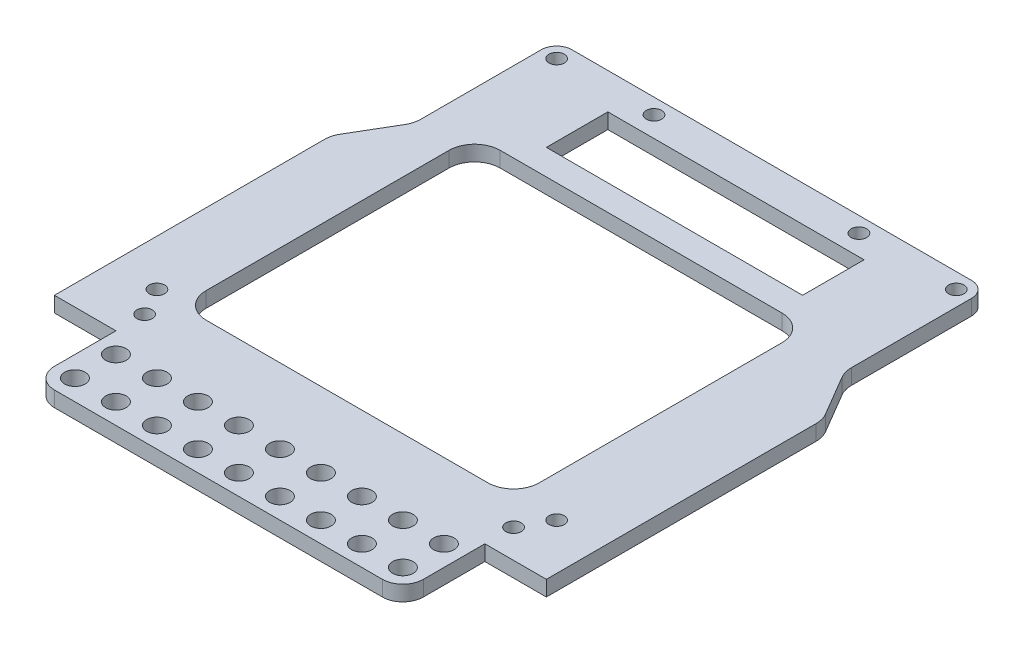
from build123d import *

# Parameters (mm, degrees)
SKETCH1_R            = 1.5
SKETCH1_R_2          = 1.65
SKETCH1_W            = 6
SKETCH1_H            = 28
BOSS_EXTRUDE1_DEPTH  = 3
CUT_EXTRUDE2_REACH   = 109.373
SKETCH3_R            = 1.5
CUT_EXTRUDE3_REACH   = 109.373
SKETCH4_W            = 22.395
SKETCH4_H            = 68
SKETCH6_W            = 51.21
SKETCH6_H            = 5
BOSS_EXTRUDE2_DEPTH  = 3
CUT_EXTRUDE4_REACH   = 109.373
SKETCH7_R            = 1.5
CUT_EXTRUDE5_REACH   = 109.373
SKETCH9_R            = 1.5
CUT_EXTRUDE6_REACH   = 109.373
SKETCH11_R           = 1.5
SKETCH11_R_2         = 2.5
BOSS_EXTRUDE3_DEPTH  = 3
CUT_EXTRUDE7_REACH   = 109.373
CUT_EXTRUDE8_START   = -3
SKETCH13_W           = 4.95
SKETCH13_H           = 15
SKETCH13_W_2         = 6.078763038
SKETCH13_H_2         = 4.767996375
CUT_EXTRUDE8_DEPTH   = 3
BOSS_EXTRUDE4_DEPTH  = 3
CUT_EXTRUDE9_REACH   = 120.849
SKETCH15_R           = 1.5
CUT_EXTRUDE10_DEPTH  = 119.84864324
SKETCH19_W           = 9
SKETCH19_H           = 48.6
SKETCH19_W_2         = 31.468413904
SKETCH19_H_2         = 28.051944454
BOSS_EXTRUDE5_DEPTH  = 3
SKETCH20_W           = 96
SKETCH20_H           = 16
CUT_EXTRUDE11_DEPTH  = 108.373181009
SKETCH22_W           = 4.143615352
SKETCH22_H           = 3.607002568
BOSS_EXTRUDE6_DEPTH  = 3
FILLET1_R            = 5
SKETCH28_W           = 50
SKETCH28_H           = 12
CUT_EXTRUDE17_DEPTH  = 94.343451832
SKETCH31_R           = 1.5
CUT_EXTRUDE19_DEPTH  = 94.343451832
SKETCH32_W           = 5.202582904
SKETCH32_H           = 21.351262034
SKETCH32_W_2         = 7.465414109
SKETCH32_H_2         = 19.935407633
SKETCH32_W_3         = 6.489723268
SKETCH32_H_3         = 24.826541016
BOSS_EXTRUDE8_DEPTH  = 3
SKETCH34_R           = 1.5
BOSS_EXTRUDE9_DEPTH  = 3
FILLET3_R            = 5
CUT_EXTRUDE20_DEPTH  = 94.343451832
SKETCH36_R           = 2
BOSS_EXTRUDE10_DEPTH = 3
SKETCH37_R           = 1.5
CUT_EXTRUDE21_DEPTH  = 10


with BuildPart() as part:
    # Sketch1 → Boss-Extrude1 (new body)
    with BuildSketch(Plane(origin=(0, 0, 0), x_dir=(1, 0, 0), z_dir=(0, 1, 0))):
        Polygon((-48, -80), (-48, 80), (48, 80), (48, -80), (48, -96), (-48, -96), align=None)
        with Locations(Location((45.5, -74, 0), (0, 0, 270))):
            Circle(SKETCH1_R, mode=Mode.SUBTRACT)
        with Locations(Location((45.5, -64, 0), (0, 0, 270))):
            Circle(SKETCH1_R, mode=Mode.SUBTRACT)
        with Locations(Location((-45.5, -64, 0), (0, 0, 270))):
            Circle(SKETCH1_R, mode=Mode.SUBTRACT)
        with Locations(Location((-45.5, -74, 0), (0, 0, 270))):
            Circle(SKETCH1_R, mode=Mode.SUBTRACT)
        with Locations(Location((8.25, -74, 0), (0, 0, 270))):
            Circle(SKETCH1_R, mode=Mode.SUBTRACT)
        with Locations(Location((8.25, -64, 0), (0, 0, 270))):
            Circle(SKETCH1_R, mode=Mode.SUBTRACT)
        with Locations(Location((0.259511597, -37.46931278, 0), (0, 0, 270))):
            Circle(SKETCH1_R_2, mode=Mode.SUBTRACT)
        with Locations(Location((15.320886036, -37.46931278, 0), (0, 0, 270))):
            Circle(SKETCH1_R_2, mode=Mode.SUBTRACT)
        with Locations(Location((15.320886036, -52.53068722, 0), (0, 0, 270))):
            Circle(SKETCH1_R_2, mode=Mode.SUBTRACT)
        with Locations(Location((0.259511597, -52.53068722, 0), (0, 0, 270))):
            Circle(SKETCH1_R_2, mode=Mode.SUBTRACT)
        with Locations(Location((17.55, -90, 0), (0, 0, 270))):
            Circle(SKETCH1_R, mode=Mode.SUBTRACT)
        with Locations(Location((45.55, -90, 0), (0, 0, 270))):
            Circle(SKETCH1_R, mode=Mode.SUBTRACT)
        with Locations(Location((-45.55, -90, 0), (0, 0, 90))):
            Circle(SKETCH1_R, mode=Mode.SUBTRACT)
        with Locations(Location((-17.55, -90, 0), (0, 0, 90))):
            Circle(SKETCH1_R, mode=Mode.SUBTRACT)
        with Locations((22.5, -45.4)):
            Rectangle(SKETCH1_W, SKETCH1_H, mode=Mode.SUBTRACT)
        Polygon((43, -80), (34.5, -80), (34.5, -31.4), (43, -31.4), (43.5, -31.4), (43.5, -58), (43, -58), align=None, mode=Mode.SUBTRACT)
    extrude(amount=BOSS_EXTRUDE1_DEPTH)

    # Sketch3 → Cut-Extrude2 (cut, up to next)
    with BuildSketch(Plane(origin=(0, 3, 0), x_dir=(1, 0, 0), z_dir=(0, 1, 0)), mode=Mode.PRIVATE) as cut_extrude2_sk1:
        with Locations(Location((0, 9, 0), (0, 0, 270))):
            Circle(SKETCH3_R)
    cut_extrude2_tool1 = extrude(cut_extrude2_sk1.sketch, amount=-CUT_EXTRUDE2_REACH, mode=Mode.PRIVATE) & part.part
    add(cut_extrude2_tool1.solids().sort_by_distance((0, 3, -9))[0], mode=Mode.SUBTRACT)

    # Sketch4 → Cut-Extrude3 (cut, up to next)
    with BuildSketch(Plane(origin=(0, 3, 0), x_dir=(1, 0, 0), z_dir=(0, 1, 0)), mode=Mode.PRIVATE) as cut_extrude3_sk1:
        with Locations((36.8025, 46)):
            Rectangle(SKETCH4_W, SKETCH4_H)
    cut_extrude3_tool1 = extrude(cut_extrude3_sk1.sketch, amount=-CUT_EXTRUDE3_REACH, mode=Mode.PRIVATE) & part.part
    # Sketch4 → Cut-Extrude3 (cut, up to next)
    with BuildSketch(Plane(origin=(0, 3, 0), x_dir=(1, 0, 0), z_dir=(0, 1, 0)), mode=Mode.PRIVATE) as cut_extrude3_sk2:
        with Locations((-36.8025, 46)):
            Rectangle(SKETCH4_W, SKETCH4_H)
    cut_extrude3_tool2 = extrude(cut_extrude3_sk2.sketch, amount=-CUT_EXTRUDE3_REACH, mode=Mode.PRIVATE) & part.part
    add(cut_extrude3_tool1.solids().sort_by_distance((36.8025, 3, -46))[0], mode=Mode.SUBTRACT)
    add(cut_extrude3_tool2.solids().sort_by_distance((-36.8025, 3, -46))[0], mode=Mode.SUBTRACT)

    # Sketch6 → Boss-Extrude2 (add)
    with BuildSketch(Plane(origin=(0, 3, 0), x_dir=(1, 0, 0), z_dir=(0, 1, 0))):
        with Locations((0, 82.5)):
            Rectangle(SKETCH6_W, SKETCH6_H)
    extrude(amount=-BOSS_EXTRUDE2_DEPTH)

    # Sketch7 → Cut-Extrude4 (cut, up to next)
    with BuildSketch(Plane(origin=(0, 3, 0), x_dir=(1, 0, 0), z_dir=(0, 1, 0)), mode=Mode.PRIVATE) as cut_extrude4_sk1:
        with Locations(Location((-17.8495, 79.268380868, 0), (0, 0, 270))):
            Circle(SKETCH7_R)
    cut_extrude4_tool1 = extrude(cut_extrude4_sk1.sketch, amount=-CUT_EXTRUDE4_REACH, mode=Mode.PRIVATE) & part.part
    # Sketch7 → Cut-Extrude4 (cut, up to next)
    with BuildSketch(Plane(origin=(0, 3, 0), x_dir=(1, 0, 0), z_dir=(0, 1, 0)), mode=Mode.PRIVATE) as cut_extrude4_sk2:
        with Locations(Location((17.8495, 79.268380868, 0), (0, 0, 270))):
            Circle(SKETCH7_R)
    cut_extrude4_tool2 = extrude(cut_extrude4_sk2.sketch, amount=-CUT_EXTRUDE4_REACH, mode=Mode.PRIVATE) & part.part
    add(cut_extrude4_tool1.solids().sort_by_distance((-17.8495, 3, -79.268381))[0], mode=Mode.SUBTRACT)
    add(cut_extrude4_tool2.solids().sort_by_distance((17.8495, 3, -79.268381))[0], mode=Mode.SUBTRACT)

    # Sketch9 → Cut-Extrude5 (cut, up to next)
    with BuildSketch(Plane(origin=(0, 3, 0), x_dir=(1, 0, 0), z_dir=(0, 1, 0)), mode=Mode.PRIVATE) as cut_extrude5_sk1:
        with Locations(Location((-22.6907969, 44, 0), (0, 0, 270))):
            Circle(SKETCH9_R)
    cut_extrude5_tool1 = extrude(cut_extrude5_sk1.sketch, amount=-CUT_EXTRUDE5_REACH, mode=Mode.PRIVATE) & part.part
    # Sketch9 → Cut-Extrude5 (cut, up to next)
    with BuildSketch(Plane(origin=(0, 3, 0), x_dir=(1, 0, 0), z_dir=(0, 1, 0)), mode=Mode.PRIVATE) as cut_extrude5_sk2:
        with Locations(Location((22.6907969, 44, 0), (0, 0, 270))):
            Circle(SKETCH9_R)
    cut_extrude5_tool2 = extrude(cut_extrude5_sk2.sketch, amount=-CUT_EXTRUDE5_REACH, mode=Mode.PRIVATE) & part.part
    add(cut_extrude5_tool1.solids().sort_by_distance((-22.690797, 3, -44))[0], mode=Mode.SUBTRACT)
    add(cut_extrude5_tool2.solids().sort_by_distance((22.690797, 3, -44))[0], mode=Mode.SUBTRACT)

    # Sketch10 → Cut-Extrude6 (cut, up to next)
    with BuildSketch(Plane(origin=(0, 3, 0), x_dir=(1, 0, 0), z_dir=(0, 1, 0)), mode=Mode.PRIVATE) as cut_extrude6_sk1:
        Polygon((48, -26), (25.605, 12), (48, 12), align=None)
    cut_extrude6_tool1 = extrude(cut_extrude6_sk1.sketch, amount=-CUT_EXTRUDE6_REACH, mode=Mode.PRIVATE) & part.part
    # Sketch10 → Cut-Extrude6 (cut, up to next)
    with BuildSketch(Plane(origin=(0, 3, 0), x_dir=(1, 0, 0), z_dir=(0, 1, 0)), mode=Mode.PRIVATE) as cut_extrude6_sk2:
        Polygon((-48, -26), (-48, 12), (-25.605, 12), align=None)
    cut_extrude6_tool2 = extrude(cut_extrude6_sk2.sketch, amount=-CUT_EXTRUDE6_REACH, mode=Mode.PRIVATE) & part.part
    add(cut_extrude6_tool1.solids().sort_by_distance((40.535, 3, 0.666667))[0], mode=Mode.SUBTRACT)
    add(cut_extrude6_tool2.solids().sort_by_distance((-40.535, 3, 0.666667))[0], mode=Mode.SUBTRACT)

    # Sketch11 → Boss-Extrude3 (add)
    # profile 1 of 2: a face of its own
    with BuildSketch(Plane.XZ):
        with BuildLine():
            Line((-45.873798612, -40.351535952), (-25.605, -52.641311078))
            Line((-25.605, -52.641311078), (-25.605, -35.641311078))
            Line((-25.605, -35.641311078), (-31.796655586, -35.641311078))
            Line((-31.796655586, -35.641311078), (-42.885371512, -33.037114659))
            ThreePointArc((-42.885371512, -33.037114659), (-47.502761912, -35.418300045), (-45.873798612, -40.351535952))
        make_face()
        with Locations(Location((-32.930328676, -41.931167665, 0), (0, 0, 270))):
            Circle(SKETCH11_R, mode=Mode.SUBTRACT)
        with Locations(Location((-43.799893893, -36.931167665, 0), (0, 0, 270))):
            Circle(SKETCH11_R_2, mode=Mode.SUBTRACT)
    # profile 2 of 2: a face of its own
    with BuildSketch(Plane.XZ):
        with BuildLine():
            Line((25.605, -35.641311078), (25.605, -52.641311078))
            Line((25.605, -52.641311078), (45.873798612, -40.351535952))
            ThreePointArc((45.873798612, -40.351535952), (47.502761912, -35.418300045), (42.885371512, -33.037114659))
            Line((42.885371512, -33.037114659), (31.796655586, -35.641311078))
            Line((31.796655586, -35.641311078), (25.605, -35.641311078))
        make_face()
        with Locations(Location((32.930328676, -41.931167665, 0), (0, 0, 270))):
            Circle(SKETCH11_R, mode=Mode.SUBTRACT)
        with Locations(Location((43.799893893, -36.931167665, 0), (0, 0, 270))):
            Circle(SKETCH11_R_2, mode=Mode.SUBTRACT)
    extrude(amount=-BOSS_EXTRUDE3_DEPTH)

    # Sketch12 → Cut-Extrude7 (cut, up to next)
    with BuildSketch(Plane.XZ, mode=Mode.PRIVATE) as cut_extrude7_sk1:
        Polygon((-11.899893893, -39.441311078), (-11.899893893, -54.741311078), (12.200106107, -54.741311078), (12.200106107, -39.441311078), (17.036431901, -39.441311078), (17.164018107, -32.041311078), (12.200106107, -32.041311078), (12.200106107, -31.191311078), (12.200106107, -25.191311078), (12.200106107, -19.091311078), (-3.799893893, -19.091311078), (-3.799893893, -30.391311078), (-11.899893893, -30.391311078), (-11.899893893, -32.041311078), (-16.849893893, -32.041311078), (-16.849893893, -39.441311078), align=None)
    cut_extrude7_tool1 = extrude(cut_extrude7_sk1.sketch, amount=-CUT_EXTRUDE7_REACH, mode=Mode.PRIVATE) & part.part
    add(cut_extrude7_tool1.solids().sort_by_distance((1.013826, 0, -38.139532))[0], mode=Mode.SUBTRACT)

    # Sketch13 → Cut-Extrude8 (cut)
    with BuildSketch(Plane.XZ.offset(CUT_EXTRUDE8_START)):
        with Locations((-14.374893893, -36.541311078)):
            Rectangle(SKETCH13_W, SKETCH13_H)
        with Locations((14.675106107, -36.541311078)):
            Rectangle(SKETCH13_W, SKETCH13_H)
        with Locations((15.239487626, -48.991959171)):
            Rectangle(SKETCH13_W_2, SKETCH13_H_2)
    extrude(amount=CUT_EXTRUDE8_DEPTH, mode=Mode.SUBTRACT)

    # Sketch14 → Boss-Extrude4 (add)
    with BuildSketch(Plane.XZ):
        with BuildLine():
            Line((-62, -85), (-25.605, -85))
            Line((-25.605, -85), (-25.605, -72))
            Line((-25.605, -72), (-70, -72))
            Line((-70, -72), (-70, -77))
            ThreePointArc((-70, -77), (-67.656854249, -82.656854249), (-62, -85))
        make_face()
        with BuildLine():
            Line((25.605, -72), (25.605, -85))
            Line((25.605, -85), (62, -85))
            ThreePointArc((62, -85), (67.656854249, -82.656854249), (70, -77))
            Line((70, -77), (70, -72))
            Line((70, -72), (25.605, -72))
        make_face()
    extrude(amount=-BOSS_EXTRUDE4_DEPTH)

    # Sketch15 → Cut-Extrude9 (cut, up to next)
    with BuildSketch(Plane(origin=(0, 3, 0), x_dir=(1, 0, 0), z_dir=(0, 1, 0)), mode=Mode.PRIVATE) as cut_extrude9_sk1:
        with Locations(Location((-20, 9, 0), (0, 0, 270))):
            Circle(SKETCH15_R)
    cut_extrude9_tool1 = extrude(cut_extrude9_sk1.sketch, amount=-CUT_EXTRUDE9_REACH, mode=Mode.PRIVATE) & part.part
    # Sketch15 → Cut-Extrude9 (cut, up to next)
    with BuildSketch(Plane(origin=(0, 3, 0), x_dir=(1, 0, 0), z_dir=(0, 1, 0)), mode=Mode.PRIVATE) as cut_extrude9_sk2:
        with Locations(Location((20, 9, 0), (0, 0, 270))):
            Circle(SKETCH15_R)
    cut_extrude9_tool2 = extrude(cut_extrude9_sk2.sketch, amount=-CUT_EXTRUDE9_REACH, mode=Mode.PRIVATE) & part.part
    add(cut_extrude9_tool1.solids().sort_by_distance((-20, 3, -9))[0], mode=Mode.SUBTRACT)
    add(cut_extrude9_tool2.solids().sort_by_distance((20, 3, -9))[0], mode=Mode.SUBTRACT)

    # Sketch18 → Cut-Extrude10 (cut, through all)
    with BuildSketch(Plane(origin=(0, 3, 0), x_dir=(1, 0, 0), z_dir=(0, 1, 0))):
        Polygon((-87.931846418, 12), (-25.605, 12), (25.605, 12), (83.08251035, 12), (83.08251035, 92.113601242), (-87.931846418, 92.113601242), align=None)
    extrude(amount=-CUT_EXTRUDE10_DEPTH, mode=Mode.SUBTRACT)

    # Sketch19 → Boss-Extrude5 (add, through all)
    with BuildSketch(Plane(origin=(0, 3, 0), x_dir=(1, 0, 0), z_dir=(0, 1, 0))):
        with Locations((39, -55.7)):
            Rectangle(SKETCH19_W, SKETCH19_H)
        with Locations((9.765793048, -45.425972227)):
            Rectangle(SKETCH19_W_2, SKETCH19_H_2)
    extrude(amount=-BOSS_EXTRUDE5_DEPTH)

    # Sketch20 → Cut-Extrude11 (cut, through all)
    with BuildSketch(Plane(origin=(0, 3, 0), x_dir=(1, 0, 0), z_dir=(0, 1, 0))):
        with Locations((0, -88)):
            Rectangle(SKETCH20_W, SKETCH20_H)
    extrude(amount=-CUT_EXTRUDE11_DEPTH, mode=Mode.SUBTRACT)

    # Sketch22 → Boss-Extrude6 (add, through all)
    with BuildSketch(Plane(origin=(0, 3, 0), x_dir=(1, 0, 0), z_dir=(0, 1, 0))):
        with Locations((0, 9)):
            Rectangle(SKETCH22_W, SKETCH22_H)
    extrude(amount=-BOSS_EXTRUDE6_DEPTH)

    # Fillet1
    fillet1_edges = [part.edges().sort_by_distance(p)[0] for p in [
        (-25.605, 1.5, -12),
        (25.605, 1.5, -12),
        (48, 1.5, 26),
        (-48, 1.5, 26),
    ]]
    fillet(fillet1_edges, radius=FILLET1_R)

    # Sketch28 → Cut-Extrude17 (cut, through all)
    with BuildSketch(Plane(origin=(0, 3, 0), x_dir=(1, 0, 0), z_dir=(0, 1, 0))):
        with Locations((0, -1)):
            Rectangle(SKETCH28_W, SKETCH28_H)
    extrude(amount=-CUT_EXTRUDE17_DEPTH, mode=Mode.SUBTRACT)

    # Sketch31 → Cut-Extrude19 (cut, through all)
    with BuildSketch(Plane.XZ):
        with Locations(Location((36, 74.4, 0), (0, 0, 270))):
            Circle(SKETCH31_R)
        with Locations(Location((-36, 74.4, 0), (0, 0, 90))):
            Circle(SKETCH31_R)
    extrude(amount=-CUT_EXTRUDE19_DEPTH, mode=Mode.SUBTRACT)

    # Sketch32 → Boss-Extrude8 (add, through all)
    with BuildSketch(Plane.XZ):
        with Locations((-45.398708548, 69.324368983)):
            Rectangle(SKETCH32_W, SKETCH32_H)
        with Locations((7.658485165, 70.032296183)):
            Rectangle(SKETCH32_W_2, SKETCH32_H_2)
        with Locations((44.755138366, 67.586729492)):
            Rectangle(SKETCH32_W_3, SKETCH32_H_3)
    extrude(amount=-BOSS_EXTRUDE8_DEPTH)

    # Sketch34 → Boss-Extrude9 (add, through all)
    # profile 1 of 4: a face of its own
    with BuildSketch(Plane.XZ):
        with Locations((-39, 69)):
            Circle(SKETCH34_R)
    # profile 2 of 4: a face of its own
    with BuildSketch(Plane.XZ):
        with Locations((39, 69)):
            Circle(SKETCH34_R)
    # profile 3 of 4: a face of its own
    with BuildSketch(Plane.XZ):
        with BuildLine():
            Line((-21.740709792, -12), (-39, -12))
            ThreePointArc((-39, -12), (-41.121320344, -11.121320344), (-42, -9))
            Line((-42, -9), (-42, 15.819156062))
            Line((-42, 15.819156062), (-21.740709792, -12))
        make_face()
        with Locations(Location((-39, -9, 0), (0, 0, 270))):
            Circle(SKETCH34_R, mode=Mode.SUBTRACT)
    # profile 4 of 4: a face of its own
    with BuildSketch(Plane.XZ):
        with BuildLine():
            Line((42, 15.819156062), (21.740709792, -12))
            Line((21.740709792, -12), (39, -12))
            ThreePointArc((39, -12), (41.121320344, -11.121320344), (42, -9))
            Line((42, -9), (42, 15.819156062))
        make_face()
        with Locations(Location((39, -9, 0), (0, 0, 270))):
            Circle(SKETCH34_R, mode=Mode.SUBTRACT)
    extrude(amount=-BOSS_EXTRUDE9_DEPTH)

    # Fillet3
    fillet3_edges = [part.edges().sort_by_distance(p)[0] for p in [
        (-42, 1.5, 15.819156062),
        (42, 1.5, 15.819156062),
    ]]
    fillet(fillet3_edges, radius=FILLET3_R)

    # Sketch35 → Cut-Extrude20 (cut, through all)
    with BuildSketch(Plane(origin=(0, 3, 0), x_dir=(1, 0, 0), z_dir=(0, 1, 0))):
        with BuildLine():
            Line((-29, -69.4), (26, -69.4))
            ThreePointArc((26, -69.4), (29.535533906, -67.935533906), (31, -64.4))
            Line((31, -64.4), (31, -17))
            ThreePointArc((31, -17), (29.535533906, -13.464466094), (26, -12))
            Line((26, -12), (-29, -12))
            ThreePointArc((-29, -12), (-32.535533906, -13.464466094), (-34, -17))
            Line((-34, -17), (-34, -64.4))
            ThreePointArc((-34, -64.4), (-32.535533906, -67.935533906), (-29, -69.4))
        make_face()
    extrude(amount=-CUT_EXTRUDE20_DEPTH, mode=Mode.SUBTRACT)

    # Sketch36 → Boss-Extrude10 (add, through all)
    with BuildSketch(Plane(origin=(0, 3, 0), x_dir=(1, 0, 0), z_dir=(0, 1, 0))):
        with BuildLine():
            Line((-32, -96), (32, -96))
            ThreePointArc((32, -96), (34.828427125, -94.828427125), (36, -92))
            Line((36, -92), (36, -80))
            Line((36, -80), (-36, -80))
            Line((-36, -80), (-36, -92))
            ThreePointArc((-36, -92), (-34.828427125, -94.828427125), (-32, -96))
        make_face()
        with Locations(Location((-32, -92, 0), (0, 0, 270))):
            Circle(SKETCH36_R, mode=Mode.SUBTRACT)
        with Locations(Location((-24, -92, 0), (0, 0, 270))):
            Circle(SKETCH36_R, mode=Mode.SUBTRACT)
        with Locations(Location((-16, -92, 0), (0, 0, 270))):
            Circle(SKETCH36_R, mode=Mode.SUBTRACT)
        with Locations(Location((-8, -92, 0), (0, 0, 270))):
            Circle(SKETCH36_R, mode=Mode.SUBTRACT)
        with Locations(Location((0, -92, 0), (0, 0, 270))):
            Circle(SKETCH36_R, mode=Mode.SUBTRACT)
        with Locations(Location((8, -92, 0), (0, 0, 270))):
            Circle(SKETCH36_R, mode=Mode.SUBTRACT)
        with Locations(Location((16, -92, 0), (0, 0, 270))):
            Circle(SKETCH36_R, mode=Mode.SUBTRACT)
        with Locations(Location((24, -92, 0), (0, 0, 270))):
            Circle(SKETCH36_R, mode=Mode.SUBTRACT)
        with Locations(Location((32, -92, 0), (0, 0, 270))):
            Circle(SKETCH36_R, mode=Mode.SUBTRACT)
        with Locations(Location((-32, -84, 0), (0, 0, 270))):
            Circle(SKETCH36_R, mode=Mode.SUBTRACT)
        with Locations(Location((-24, -84, 0), (0, 0, 270))):
            Circle(SKETCH36_R, mode=Mode.SUBTRACT)
        with Locations(Location((-16, -84, 0), (0, 0, 270))):
            Circle(SKETCH36_R, mode=Mode.SUBTRACT)
        with Locations(Location((-8, -84, 0), (0, 0, 270))):
            Circle(SKETCH36_R, mode=Mode.SUBTRACT)
        with Locations(Location((0, -84, 0), (0, 0, 270))):
            Circle(SKETCH36_R, mode=Mode.SUBTRACT)
        with Locations(Location((8, -84, 0), (0, 0, 270))):
            Circle(SKETCH36_R, mode=Mode.SUBTRACT)
        with Locations(Location((16, -84, 0), (0, 0, 270))):
            Circle(SKETCH36_R, mode=Mode.SUBTRACT)
        with Locations(Location((24, -84, 0), (0, 0, 270))):
            Circle(SKETCH36_R, mode=Mode.SUBTRACT)
        with Locations(Location((32, -84, 0), (0, 0, 270))):
            Circle(SKETCH36_R, mode=Mode.SUBTRACT)
    extrude(amount=-BOSS_EXTRUDE10_DEPTH)

    # Sketch37 → Cut-Extrude21 (cut)
    with BuildSketch(Plane.XZ):
        with Locations(Location((-39, 69, 0), (0, 0, 270))):
            Circle(SKETCH37_R)
        with Locations(Location((39, 69, 0), (0, 0, 270))):
            Circle(SKETCH37_R)
    extrude(amount=-CUT_EXTRUDE21_DEPTH, mode=Mode.SUBTRACT)


solid = part.part
